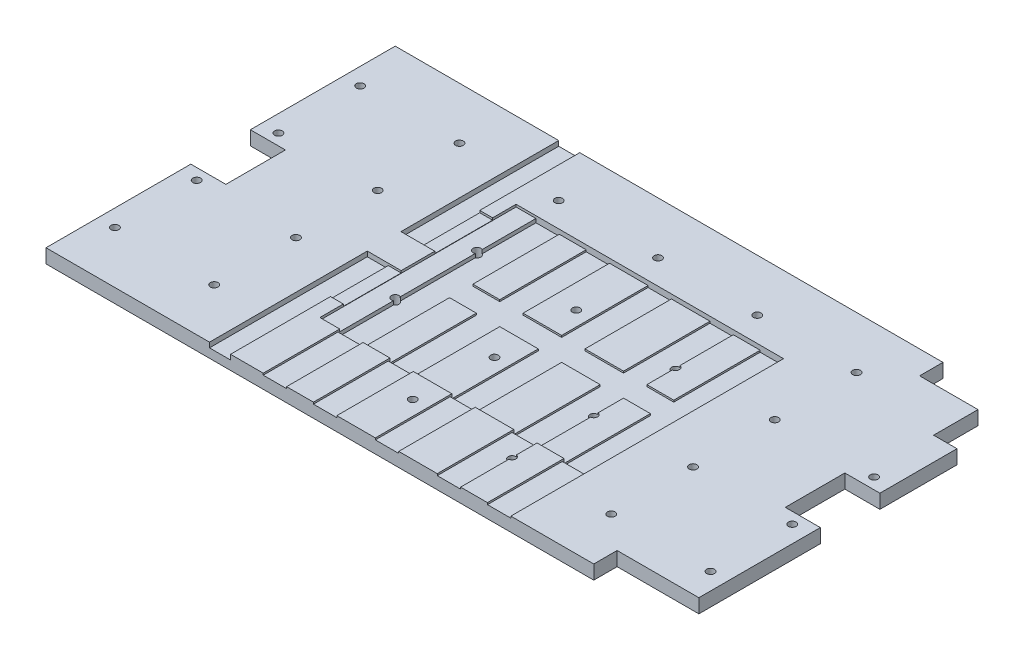
from build123d import *

# Parameters (mm, degrees)
SKETCH1_W            = 539
SKETCH1_H            = 299
BOSS_EXTRUDE1_DEPTH  = 12
SKETCH15_W           = 70
SKETCH15_H           = 20
CUT_EXTRUDE8_DEPTH   = 309.422599691
SKETCH2_W            = 30
SKETCH2_H            = 51
CUT_EXTRUDE1_DEPTH   = 309.422599691
SKETCH4_W            = 229
SKETCH4_H            = 168
CUT_EXTRUDE2_DEPTH   = 3.75
SKETCH5_W            = 18
SKETCH5_H            = 299
CUT_EXTRUDE3_DEPTH   = 4.25
SKETCH6_W            = 11
SKETCH6_H            = 49.5
CUT_EXTRUDE4_DEPTH   = 1.75
SKETCH7_W            = 17
SKETCH7_H            = 168
BOSS_EXTRUDE3_DEPTH  = 1.7
M6_CLEARANCE_HOLE1_D = 6.6
SKETCH10_W           = 18
SKETCH10_H           = 28.8
BOSS_EXTRUDE4_DEPTH  = 4.25
CUT_EXTRUDE5_DEPTH   = 1.5
SKETCH13_W           = 20
SKETCH13_H           = 1.5
CUT_EXTRUDE6_DEPTH   = 5.25
SKETCH14_W           = 20
SKETCH14_H           = 64
CUT_EXTRUDE7_DEPTH   = 1.5


with BuildPart() as part:
    # Sketch1 → Boss-Extrude1 (new body)
    with BuildSketch(Plane(origin=(0, 0, 0), x_dir=(1, 0, 0), z_dir=(0, 1, 0))):
        Rectangle(SKETCH1_W, SKETCH1_H)
    extrude(amount=-BOSS_EXTRUDE1_DEPTH)

    # Sketch15 → Cut-Extrude8 (cut, through all)
    with BuildSketch(Plane(origin=(0, 0, 0), x_dir=(1, 0, 0), z_dir=(0, 1, 0))):
        Polygon((269.5, 149.5), (199.5, 149.5), (199.5, 129.5), (249.5, 129.5), (249.5, 91.5), (269.5, 91.5), align=None)
        with Locations((234.5, -139.5)):
            Rectangle(SKETCH15_W, SKETCH15_H)
    extrude(amount=-CUT_EXTRUDE8_DEPTH, mode=Mode.SUBTRACT)

    # Sketch2 → Cut-Extrude1 (cut, through all)
    with BuildSketch(Plane(origin=(0, 0, 0), x_dir=(1, 0, 0), z_dir=(0, 1, 0))):
        with Locations((-254.5, 0)):
            Rectangle(SKETCH2_W, SKETCH2_H)
    cut_extrude1 = extrude(amount=-CUT_EXTRUDE1_DEPTH, mode=Mode.SUBTRACT)

    # Mirror1: Cut-Extrude1 across plane
    add(cut_extrude1.mirror(Plane(origin=(0, 0, 0), x_dir=(0, 0, 1), z_dir=(1, 0, 0))), mode=Mode.SUBTRACT)

    # Sketch4 → Cut-Extrude2 (cut)
    with BuildSketch(Plane(origin=(0, 0, 0), x_dir=(1, 0, 0), z_dir=(0, 1, 0))):
        with Locations((14, 0)):
            Rectangle(SKETCH4_W, SKETCH4_H)
    extrude(amount=-CUT_EXTRUDE2_DEPTH, mode=Mode.SUBTRACT)

    # Sketch5 → Cut-Extrude3 (cut)
    with BuildSketch(Plane(origin=(0, 0, 0), x_dir=(1, 0, 0), z_dir=(0, 1, 0))):
        with Locations((-120.5, 0)):
            Rectangle(SKETCH5_W, SKETCH5_H)
    extrude(amount=-CUT_EXTRUDE3_DEPTH, mode=Mode.SUBTRACT)

    # Sketch6 → Cut-Extrude4 (cut)
    with BuildSketch(Plane(origin=(0, 0, 0), x_dir=(1, 0, 0), z_dir=(0, 1, 0))):
        with Locations((-106, 39.15)):
            Rectangle(SKETCH6_W, SKETCH6_H)
        with Locations((-106, -39.15)):
            Rectangle(SKETCH6_W, SKETCH6_H)
    extrude(amount=-CUT_EXTRUDE4_DEPTH, mode=Mode.SUBTRACT)

    # Sketch7 → Boss-Extrude3 (add)
    with BuildSketch(Plane(origin=(0, -3.75, 0), x_dir=(1, 0, 0), z_dir=(0, 1, 0))):
        with Locations((-92, 0)):
            Rectangle(SKETCH7_W, SKETCH7_H)
    extrude(amount=BOSS_EXTRUDE3_DEPTH)

    # M6 Clearance Hole1 (through all)
    with Locations(Plane(origin=(-255, -12, 105), x_dir=(0, 0, -1), z_dir=(0, -1, 0))):
        with Locations((0, 0), (70, 0), (210, 0), (140, 0), (210, 85), (140, 85), (70, 85), (0, 85), (0, 255), (0, 340), (0, 425), (0, 510), (70, 510), (70, 425), (70, 340), (70, 255), (70, 170), (140, 170), (140, 255), (140, 340), (140, 425), (140, 510), (210, 425), (210, 340), (210, 255), (210, 170)):
            Hole(M6_CLEARANCE_HOLE1_D / 2)

    # Sketch10 → Boss-Extrude4 (add)
    with BuildSketch(Plane(origin=(0, -4.25, 0), x_dir=(1, 0, 0), z_dir=(0, 1, 0))):
        with Locations((-120.5, 0)):
            Rectangle(SKETCH10_W, SKETCH10_H)
    extrude(amount=BOSS_EXTRUDE4_DEPTH)

    # Sketch12 → Cut-Extrude5 (cut)
    with BuildSketch(Plane(origin=(0, -3.75, 0), x_dir=(1, 0, 0), z_dir=(0, 1, 0))):
        Polygon((32.5, -10), (32.5, -84), (12.5, -84), (12.5, -10), (-20.5, -10), (-20.5, -84), (-40.5, -84), (-40.5, -10), (-63.5, -10), (-63.5, -84), (-83.5, -84), (-83.5, 84), (-63.5, 84), (-63.5, 10), (-40.5, 10), (-40.5, 84), (-20.5, 84), (-20.5, 10), (12.5, 10), (12.5, 84), (32.5, 84), (32.5, 10), (65.5, 10), (65.5, 84), (85.5, 84), (85.5, 10), (108.5, 10), (108.5, 84), (128.5, 84), (128.5, -84), (108.5, -84), (108.5, -10), (85.5, -10), (85.5, -84), (65.5, -84), (65.5, -10), align=None)
    extrude(amount=-CUT_EXTRUDE5_DEPTH, mode=Mode.SUBTRACT)

    # Sketch13 → Cut-Extrude6 (cut)
    with BuildSketch(Plane(origin=(0, 0, 0), x_dir=(1, 0, 0), z_dir=(0, 1, 0))):
        with Locations((-73.5, -84.75)):
            Rectangle(SKETCH13_W, SKETCH13_H)
        with Locations((-30.5, -84.75)):
            Rectangle(SKETCH13_W, SKETCH13_H)
        with Locations((22.5, -84.75)):
            Rectangle(SKETCH13_W, SKETCH13_H)
        with Locations((75.5, -84.75)):
            Rectangle(SKETCH13_W, SKETCH13_H)
        with Locations((118.5, -84.75)):
            Rectangle(SKETCH13_W, SKETCH13_H)
    extrude(amount=-CUT_EXTRUDE6_DEPTH, mode=Mode.SUBTRACT)

    # Sketch14 → Cut-Extrude7 (cut)
    with BuildSketch(Plane(origin=(0, 0, 0), x_dir=(1, 0, 0), z_dir=(0, 1, 0))):
        with Locations((-73.5, -117.5)):
            Rectangle(SKETCH14_W, SKETCH14_H)
        with Locations((-30.5, -117.5)):
            Rectangle(SKETCH14_W, SKETCH14_H)
        with Locations((22.5, -117.5)):
            Rectangle(SKETCH14_W, SKETCH14_H)
        with Locations((75.5, -117.5)):
            Rectangle(SKETCH14_W, SKETCH14_H)
        with Locations((118.5, -117.5)):
            Rectangle(SKETCH14_W, SKETCH14_H)
    extrude(amount=-CUT_EXTRUDE7_DEPTH, mode=Mode.SUBTRACT)


solid = part.part
